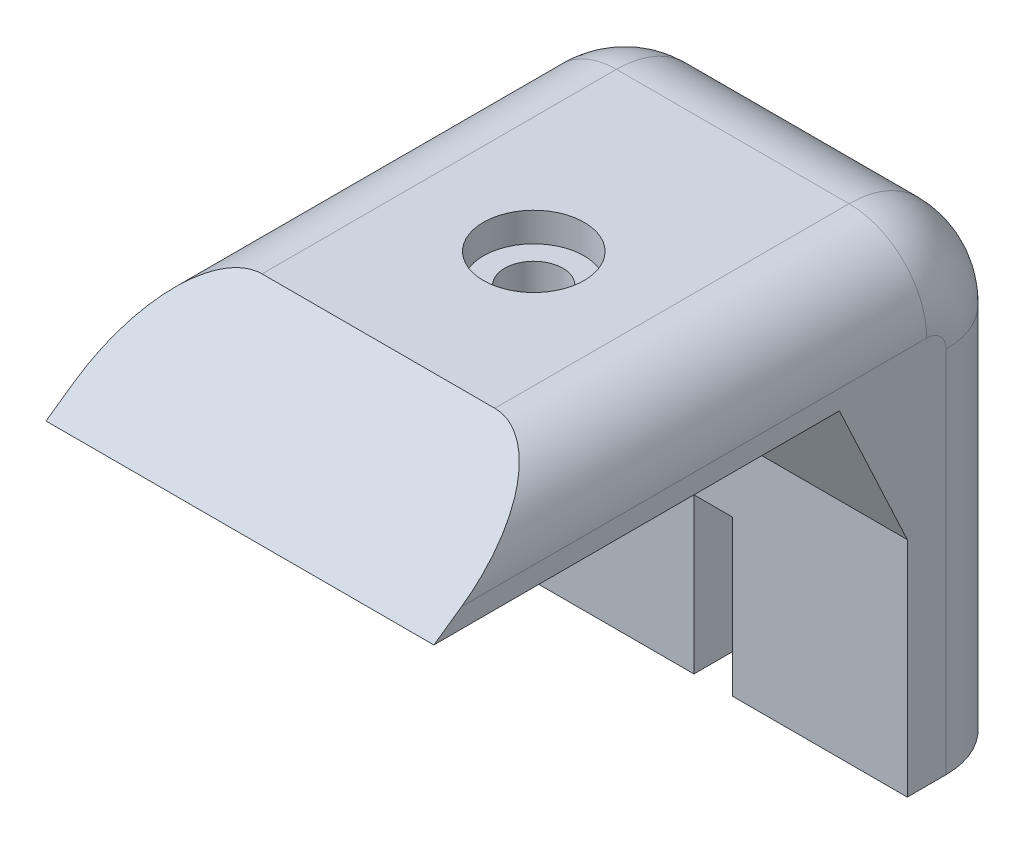
from build123d import *

# Parameters (mm, degrees)
BOSS_EXTRUDE1_DEPTH = 20
SKETCH2_W           = 9
SKETCH2_H           = 6
BOSS_EXTRUDE2_DEPTH = 8
CHAMFER1_SIZE       = 3.5
CHAMFER1_SIZE2      = 7.5
SKETCH3_R           = 1.5
CUT_EXTRUDE1_DEPTH  = 44.597859544
SKETCH3_3_R         = 2.6
SKETCH3_3_R_2       = 1.5
CUT_EXTRUDE2_DEPTH  = 1.5
FILLET1_R           = 4


with BuildPart() as part:
    # Sketch1 → Boss-Extrude1 (new body)
    with BuildSketch(Plane(origin=(0, 0, 0), x_dir=(0, 0, -1), z_dir=(1, 0, 0))):
        with BuildLine():
            Line((0, 0), (7.140740034, 5))
            Line((7.140740034, 5), (24.410086433, 5))
            Line((24.410086433, 5), (25.410086433, 5))
            ThreePointArc((25.410086433, 5), (28.945620339, 3.535533906), (30.410086433, 0))
            Line((30.410086433, 0), (30.410086433, -11))
            Line((30.410086433, -11), (24.410086433, -11))
            Line((24.410086433, -11), (24.410086433, 0))
            Line((24.410086433, 0), (0, 0))
        make_face()
    extrude(amount=BOSS_EXTRUDE1_DEPTH)

    # Sketch2 → Boss-Extrude2 (add)
    with BuildSketch(Plane.XZ.offset(11)):
        with Locations((15.5, -27.410086433)):
            Rectangle(SKETCH2_W, SKETCH2_H)
        with Locations((4.5, -27.410086433)):
            Rectangle(SKETCH2_W, SKETCH2_H)
    extrude(amount=BOSS_EXTRUDE2_DEPTH)

    # Chamfer1
    chamfer1_edges = [part.edges().sort_by_distance(p)[0] for p in [
        (10, 0, -24.410086433),
    ]]
    chamfer1_side = [part.faces().sort_by_distance(p)[0] for p in [
        (10, 0, -12.205043216),
    ]]
    chamfer(chamfer1_edges, length=CHAMFER1_SIZE, length2=CHAMFER1_SIZE2, reference=chamfer1_side[0])

    # Sketch3 → Cut-Extrude1 (cut, through all)
    with BuildSketch(Plane(origin=(0, 5, 0), x_dir=(1, 0, 0), z_dir=(0, 1, 0))):
        with Locations((10, 15.150730497)):
            Circle(SKETCH3_R)
    extrude(amount=-CUT_EXTRUDE1_DEPTH, mode=Mode.SUBTRACT)

    # Sketch3<3> → Cut-Extrude2 (cut)
    with BuildSketch(Plane(origin=(0, 5, 0), x_dir=(1, 0, 0), z_dir=(0, 1, 0))):
        with Locations((10, 15.150730497)):
            Circle(SKETCH3_3_R)
        with Locations((10, 15.150730497)):
            Circle(SKETCH3_3_R_2, mode=Mode.SUBTRACT)
    extrude(amount=-CUT_EXTRUDE2_DEPTH, mode=Mode.SUBTRACT)

    # Fillet1
    fillet1_edges = [part.edges().sort_by_distance(p)[0] for p in [
        (0, 5, -16.275413233),
        (0, 3.535533906, -28.945620339),
        (20, 5, -16.275413233),
        (20, 3.535533906, -28.945620339),
        (0, -9.5, -30.410086433),
        (20, -9.5, -30.410086433),
    ]]
    fillet(fillet1_edges, radius=FILLET1_R)


solid = part.part
